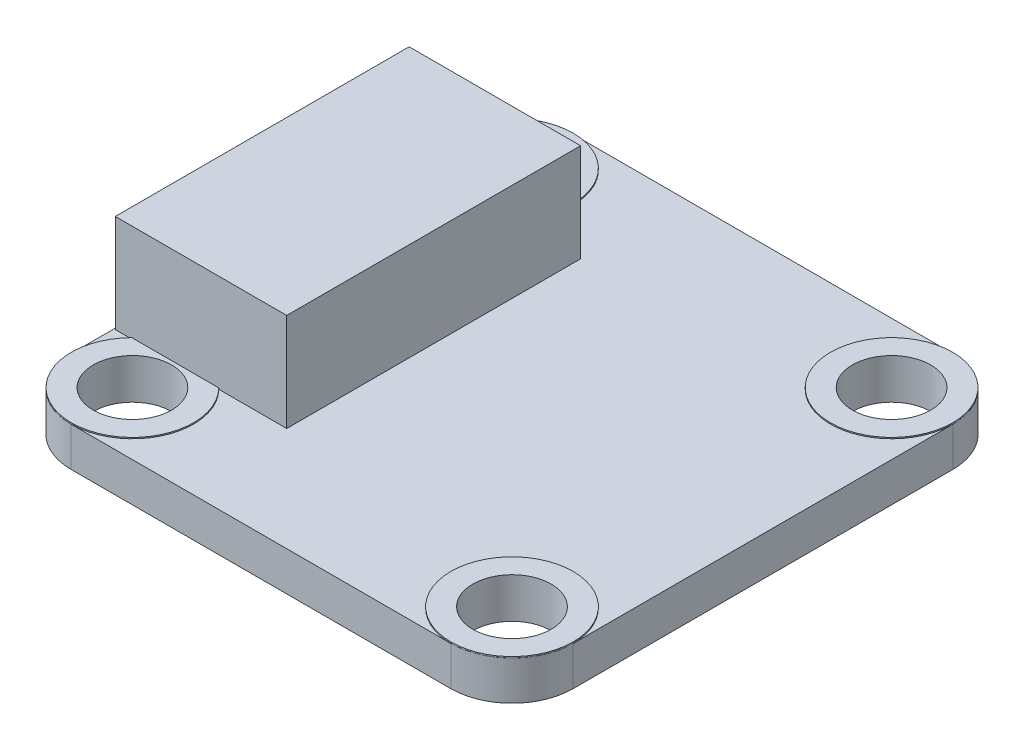
from build123d import *

# Parameters (mm, degrees)
BOSS_EXTRUDE1_DEPTH = 1.6
SKETCH2_R           = 2.495
BOSS_EXTRUDE2_DEPTH = 0.05
SKETCH3_R           = 1.6
CUT_EXTRUDE1_DEPTH  = 15.58929402
SKETCH4_W           = 7
SKETCH4_H           = 12
BOSS_EXTRUDE3_DEPTH = 4


with BuildPart() as part:
    # Sketch1 → Boss-Extrude1 (new body)
    with BuildSketch(Plane(origin=(0, 0, 0), x_dir=(1, 0, 0), z_dir=(0, 1, 0))):
        with BuildLine():
            Line((7.75, -10.25), (-7.75, -10.25))
            ThreePointArc((-7.75, -10.25), (-9.517766953, -9.517766953), (-10.25, -7.75))
            Line((-10.25, -7.75), (-10.25, 7.75))
            ThreePointArc((-10.25, 7.75), (-9.517766953, 9.517766953), (-7.75, 10.25))
            Line((-7.75, 10.25), (7.75, 10.25))
            ThreePointArc((7.75, 10.25), (9.517766953, 9.517766953), (10.25, 7.75))
            Line((10.25, 7.75), (10.25, -7.75))
            ThreePointArc((10.25, -7.75), (9.517766953, -9.517766953), (7.75, -10.25))
        make_face()
    extrude(amount=BOSS_EXTRUDE1_DEPTH)

    # Sketch2 → Boss-Extrude2 (add)
    with BuildSketch(Plane(origin=(0, 1.6, 0), x_dir=(1, 0, 0), z_dir=(0, 1, 0))):
        with Locations(Location((-7.75, 7.75, 0), (0, 0, 90))):
            Circle(SKETCH2_R)
        with Locations(Location((7.75, 7.75, 0), (0, 0, 90))):
            Circle(SKETCH2_R)
        with Locations(Location((7.75, -7.75, 0), (0, 0, 90))):
            Circle(SKETCH2_R)
        with Locations(Location((-7.75, -7.75, 0), (0, 0, 90))):
            Circle(SKETCH2_R)
    extrude(amount=BOSS_EXTRUDE2_DEPTH)

    # Sketch3 → Cut-Extrude1 (cut, through all)
    with BuildSketch(Plane(origin=(0, 1.65, 0), x_dir=(1, 0, 0), z_dir=(0, 1, 0))):
        with Locations(Location((-7.75, 7.75, 0), (0, 0, 270))):
            Circle(SKETCH3_R)
        with Locations(Location((7.75, 7.75, 0), (0, 0, 270))):
            Circle(SKETCH3_R)
        with Locations(Location((7.75, -7.75, 0), (0, 0, 270))):
            Circle(SKETCH3_R)
        with Locations(Location((-7.75, -7.75, 0), (0, 0, 270))):
            Circle(SKETCH3_R)
    extrude(amount=-CUT_EXTRUDE1_DEPTH, mode=Mode.SUBTRACT)

    # Sketch4 → Boss-Extrude3 (add)
    with BuildSketch(Plane(origin=(0, 1.6, 0), x_dir=(1, 0, 0), z_dir=(0, 1, 0))):
        with Locations((-6.7, 0)):
            Rectangle(SKETCH4_W, SKETCH4_H)
    extrude(amount=BOSS_EXTRUDE3_DEPTH)


solid = part.part
